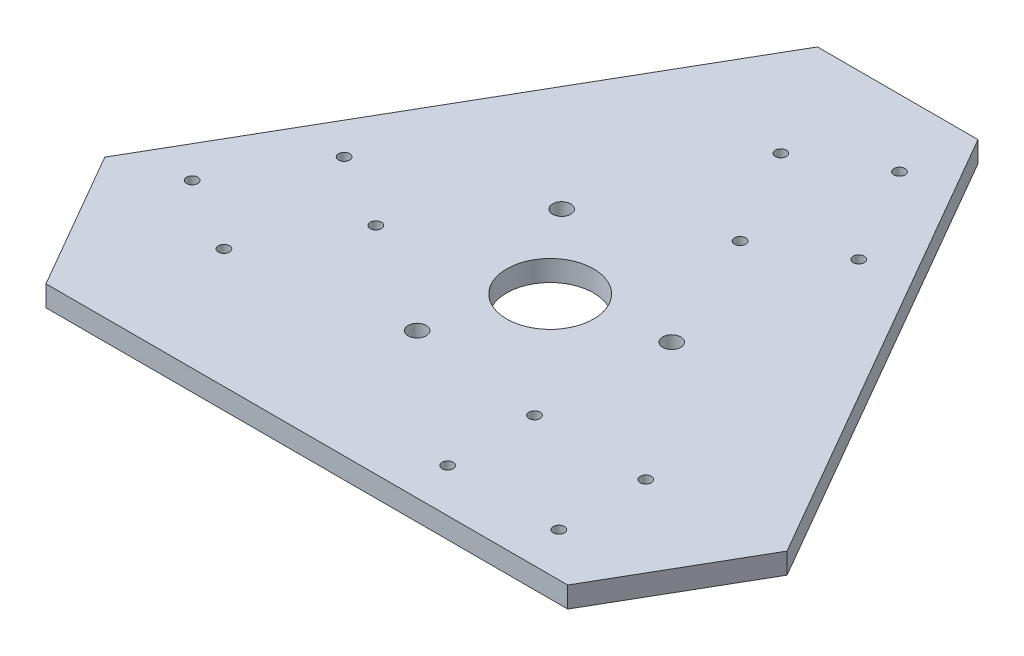
from build123d import *

# Parameters (mm, degrees)
EXTRUDE_1_DEPTH     = 6
SKETCH_2_R          = 12.5
CUT_EXTRUDE_1_DEPTH = 153.870315409
CUT_EXTRUDE_2_DEPTH = 153.870315409
SKETCH_6_R          = 2.6
CUT_EXTRUDE_5_DEPTH = 141.247400451
SKETCH_7_R          = 1.6
CUT_EXTRUDE_8_DEPTH = 141.247400451


with BuildPart() as part:
    # 草图1 → 凸台-拉伸1 (new body)
    with BuildSketch(Plane(origin=(0, 0, 0), x_dir=(1, 0, 0), z_dir=(0, 1, 0))):
        Polygon((115.470053838, 0), (57.735026919, 100), (-57.735026919, 100), (-115.470053838, 0), (-57.735026919, -100), (57.735026919, -100), align=None)
    extrude(amount=EXTRUDE_1_DEPTH)

    # 草图2 → 切除-拉伸1 (cut, through all)
    with BuildSketch(Plane(origin=(0, 6, 0), x_dir=(1, 0, 0), z_dir=(0, 1, 0))):
        with Locations(Location((0, 0, 0), (0, 0, 270))):
            Circle(SKETCH_2_R)
    extrude(amount=-CUT_EXTRUDE_1_DEPTH, mode=Mode.SUBTRACT)

    # 草图3 → 切除-拉伸2 (cut, through all)
    with BuildSketch(Plane(origin=(0, 6, 0), x_dir=(1, 0, 0), z_dir=(0, 1, 0))):
        Polygon((-23.094010768, 100), (-98.149545762, -30), (-115.470053838, 0), (-57.735026919, 100), align=None)
        Polygon((98.149545762, -30), (23.094010768, 100), (57.735026919, 100), (115.470053838, 0), align=None)
        Polygon((-75.055534995, -70), (75.055534995, -70), (57.735026919, -100), (-57.735026919, -100), align=None)
    extrude(amount=-CUT_EXTRUDE_2_DEPTH, mode=Mode.SUBTRACT)

    # 草图6 → 切除-拉伸5 (cut, through all)
    with BuildSketch(Plane(origin=(0, 6, 0), x_dir=(1, 0, 0), z_dir=(0, 1, 0))):
        with Locations(Location((-10, -28.284271247, 0), (0, 0, 270))):
            Circle(SKETCH_6_R)
        with Locations(Location((-19.494897428, 22.802389662, 0), (0, 0, 270))):
            Circle(SKETCH_6_R)
        with Locations(Location((29.494897428, 5.481881586, 0), (0, 0, 270))):
            Circle(SKETCH_6_R)
    extrude(amount=-CUT_EXTRUDE_5_DEPTH, mode=Mode.SUBTRACT)

    # 草图7 → 切除-拉伸8 (cut, through all)
    with BuildSketch(Plane(origin=(0, 0, 0), x_dir=(1, 0, 0), z_dir=(0, 1, 0))):
        with Locations(Location((60, -32.5, 0), (0, 0, 270))):
            Circle(SKETCH_7_R)
        with Locations(Location((28, -32.5, 0), (0, 0, 270))):
            Circle(SKETCH_7_R)
        with Locations(Location((60, -57.5, 0), (0, 0, 270))):
            Circle(SKETCH_7_R)
        with Locations(Location((28, -57.5, 0), (0, 0, 270))):
            Circle(SKETCH_7_R)
        with Locations(Location((-58.145825623, -35.711524227, 0), (0, 0, 270))):
            Circle(SKETCH_7_R)
        with Locations(Location((-42.145825623, -7.998711306, 0), (0, 0, 270))):
            Circle(SKETCH_7_R)
        with Locations(Location((-79.796460718, -23.211524227, 0), (0, 0, 270))):
            Circle(SKETCH_7_R)
        with Locations(Location((-63.796460718, 4.501288694, 0), (0, 0, 270))):
            Circle(SKETCH_7_R)
        with Locations(Location((-1.854174377, 68.211524227, 0), (0, 0, 270))):
            Circle(SKETCH_7_R)
        with Locations(Location((14.145825623, 40.498711306, 0), (0, 0, 270))):
            Circle(SKETCH_7_R)
        with Locations(Location((19.796460718, 80.711524227, 0), (0, 0, 270))):
            Circle(SKETCH_7_R)
        with Locations(Location((35.796460718, 52.998711306, 0), (0, 0, 270))):
            Circle(SKETCH_7_R)
    extrude(amount=CUT_EXTRUDE_8_DEPTH, mode=Mode.SUBTRACT)


solid = part.part
